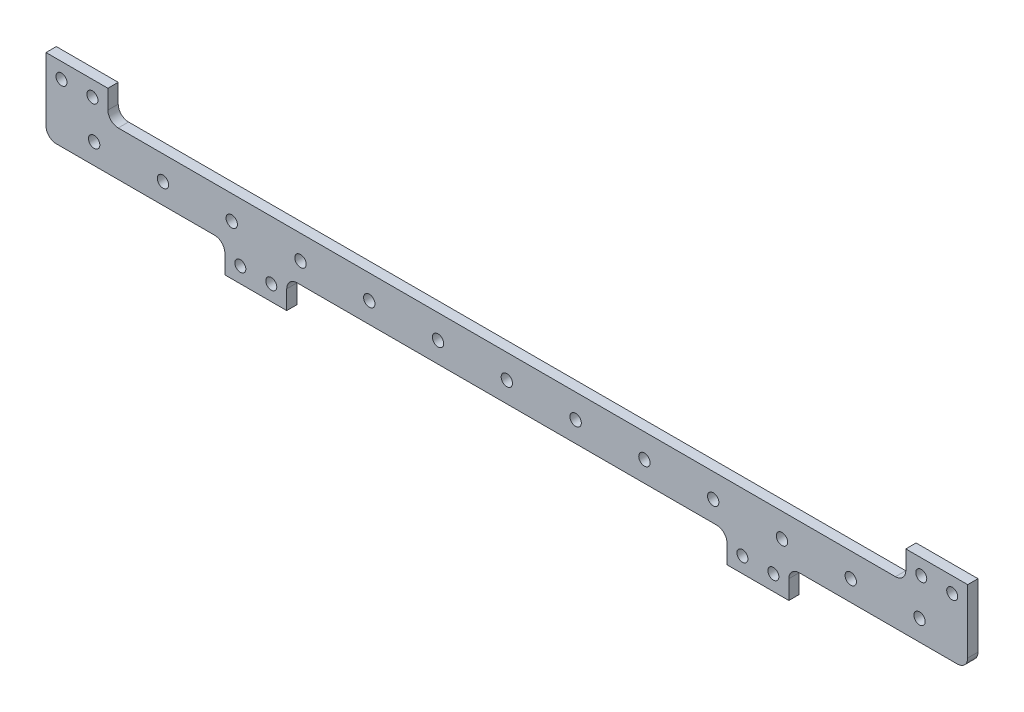
from build123d import *

# Parameters (mm, degrees)
SKETCH_1_R                 = 1.6
EXTRUDE_1_DEPTH            = 3
HOLE_WIZARD_2_D            = 3.3
PATTERN_LINEAR_1_COUNT     = 7
PATTERN_LINEAR_1_PITCH     = 20
PATTERN_LINEAR_1_COL_COUNT = 7
PATTERN_LINEAR_1_COL_PITCH = 20


with BuildPart() as part:
    # 草图1 → 凸台-拉伸1 (new body)
    with BuildSketch(Plane.XY):
        with BuildLine():
            Line((-61, 8.5), (61, 8.5))
            ThreePointArc((61, 8.5), (63.121320344, 7.621320344), (64, 5.5))
            Line((64, 5.5), (64, 0))
            Line((64, 0), (82, 0))
            Line((82, 0), (82, 5.5))
            ThreePointArc((82, 5.5), (82.878679656, 7.621320344), (85, 8.5))
            Line((85, 8.5), (131, 8.5))
            ThreePointArc((131, 8.5), (133.121320344, 9.378679656), (134, 11.5))
            Line((134, 11.5), (134, 30))
            Line((134, 30), (116, 30))
            Line((116, 30), (116, 24.5))
            ThreePointArc((116, 24.5), (115.121320344, 22.378679656), (113, 21.5))
            Line((113, 21.5), (-113, 21.5))
            ThreePointArc((-113, 21.5), (-115.121320344, 22.378679656), (-116, 24.5))
            Line((-116, 24.5), (-116, 30))
            Line((-116, 30), (-134, 30))
            Line((-134, 30), (-134, 11.5))
            ThreePointArc((-134, 11.5), (-133.121320344, 9.378679656), (-131, 8.5))
            Line((-131, 8.5), (-85, 8.5))
            ThreePointArc((-85, 8.5), (-82.878679656, 7.621320344), (-82, 5.5))
            Line((-82, 5.5), (-82, 0))
            Line((-82, 0), (-64, 0))
            Line((-64, 0), (-64, 5.5))
            ThreePointArc((-64, 5.5), (-63.121320344, 7.621320344), (-61, 8.5))
        make_face()
        with Locations((-77.5, 4.5)):
            Circle(SKETCH_1_R, mode=Mode.SUBTRACT)
        with Locations((-68.5, 4.5)):
            Circle(SKETCH_1_R, mode=Mode.SUBTRACT)
        with Locations((120.5, 25.5)):
            Circle(SKETCH_1_R, mode=Mode.SUBTRACT)
        with Locations((129.5, 25.5)):
            Circle(SKETCH_1_R, mode=Mode.SUBTRACT)
        with Locations((68.5, 4.5)):
            Circle(SKETCH_1_R, mode=Mode.SUBTRACT)
        with Locations((77.5, 4.5)):
            Circle(SKETCH_1_R, mode=Mode.SUBTRACT)
        with Locations((-129.5, 25.5)):
            Circle(SKETCH_1_R, mode=Mode.SUBTRACT)
        with Locations((-120.5, 25.5)):
            Circle(SKETCH_1_R, mode=Mode.SUBTRACT)
    extrude(amount=EXTRUDE_1_DEPTH)

    # 孔2 (through all)
    with Locations(Plane(origin=(0, 0, 0), x_dir=(-1, 0, 0), z_dir=(0, 0, -1))):
        with Locations((0, 14.5)):
            hole_wizard_2 = Hole(HOLE_WIZARD_2_D / 2)

    # 阵列(线性)1: 孔2 ×7
    with Locations(*[(i * PATTERN_LINEAR_1_PITCH, 0, 0) for i in range(1, PATTERN_LINEAR_1_COUNT)]):
        add(hole_wizard_2, mode=Mode.SUBTRACT)

    # 阵列(线性)1 col: 孔2 ×7
    with Locations(*[(-i * PATTERN_LINEAR_1_COL_PITCH, 0, 0) for i in range(1, PATTERN_LINEAR_1_COL_COUNT)]):
        add(hole_wizard_2, mode=Mode.SUBTRACT)


solid = part.part
